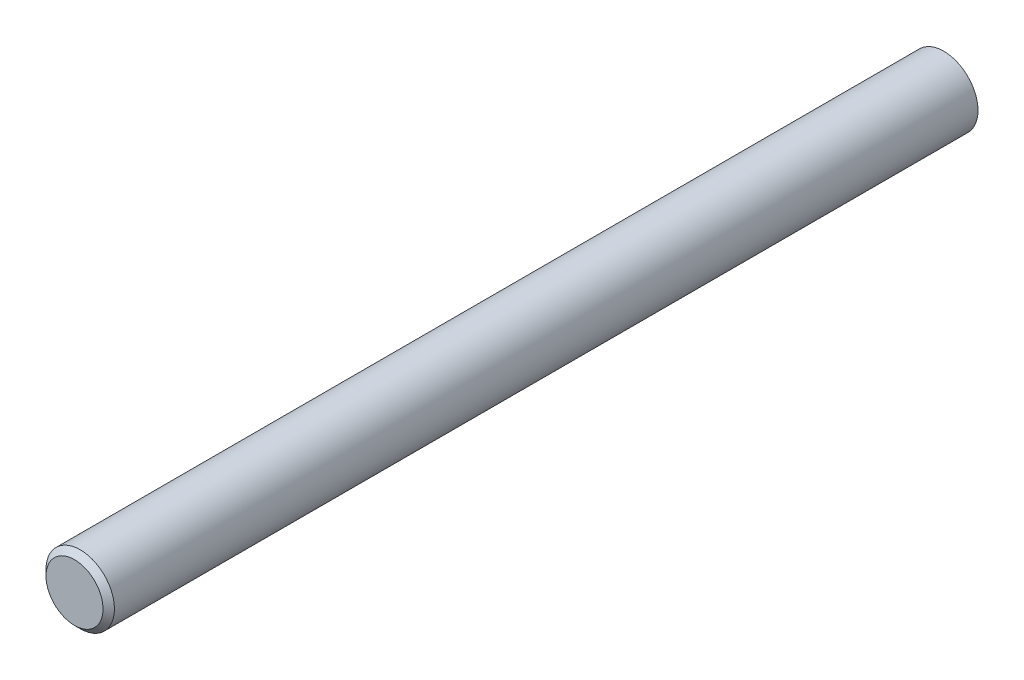
from build123d import *

# Parameters (mm, degrees)
FASE1_SIZE = 0.5


with BuildPart() as part:
    # Skizze1 → Rotation1 (revolve)
    with BuildSketch(Plane(origin=(0, 0, 0), x_dir=(0, 0, -1), z_dir=(1, 0, 0)), mode=Mode.PRIVATE) as rotation1_sk:
        Polygon((7, 3), (2, 3), (-22, 3), (-22, 0), (0, 0), (54.21752089, 0), (54.21752089, 3), align=None)
    revolve(rotation1_sk.sketch.rotate(Axis((0, 0, 22), (0, 0, -1)), 90), axis=Axis((0, 0, 22), (0, 0, -1)))

    # Fase1
    fase1_edges = [part.edges().sort_by_distance(p)[0] for p in [
        (-3, 0, 22),
    ]]
    chamfer(fase1_edges, length=FASE1_SIZE)


solid = part.part
